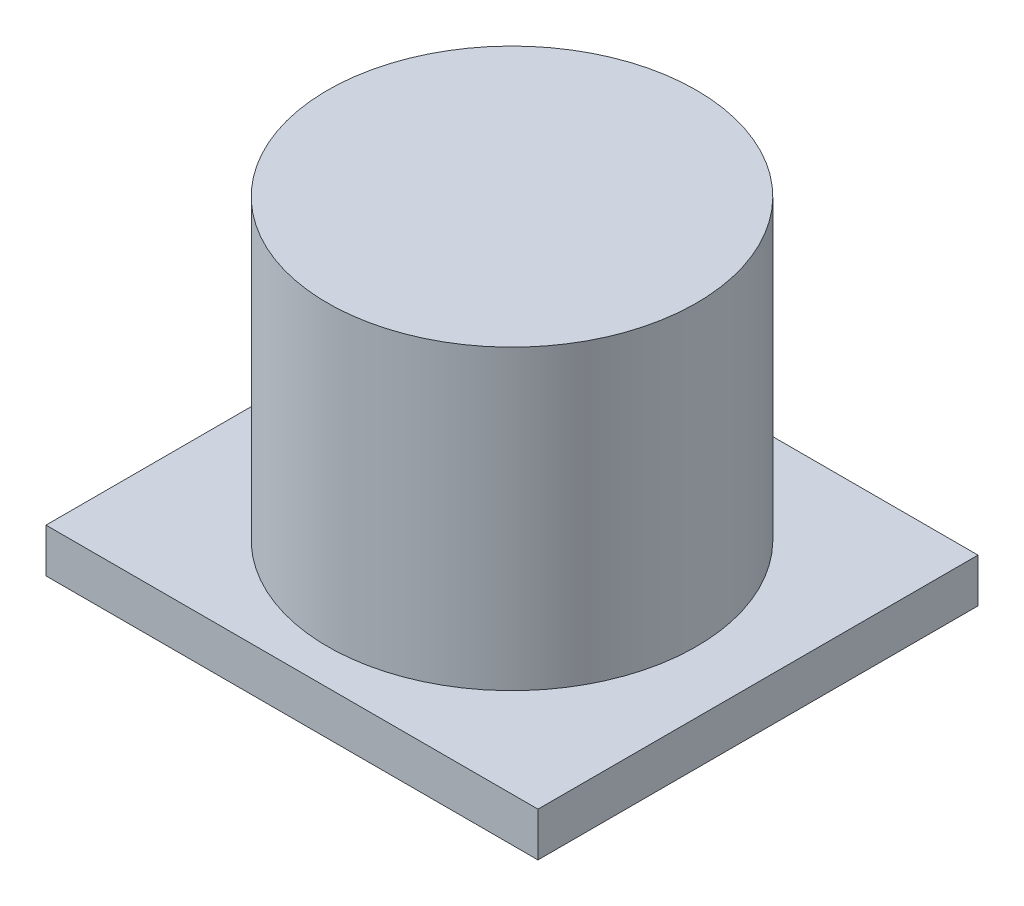
from build123d import *

# Parameters (mm, degrees)
SKETCH1_W           = 22.36
SKETCH1_H           = 20
BOSS_EXTRUDE1_DEPTH = 2
SKETCH2_R           = 8.382
BOSS_EXTRUDE2_DEPTH = 13.52


with BuildPart() as part:
    # Sketch1 → Boss-Extrude1 (new body)
    with BuildSketch(Plane(origin=(0, 0, 0), x_dir=(1, 0, 0), z_dir=(0, 1, 0))):
        Rectangle(SKETCH1_W, SKETCH1_H)
    extrude(amount=BOSS_EXTRUDE1_DEPTH)

    # Sketch2 → Boss-Extrude2 (add)
    with BuildSketch(Plane(origin=(0, 2, 0), x_dir=(1, 0, 0), z_dir=(0, 1, 0))):
        with Locations(Location((0, 0, 0), (0, 0, 90))):
            Circle(SKETCH2_R)
    extrude(amount=BOSS_EXTRUDE2_DEPTH)


solid = part.part
